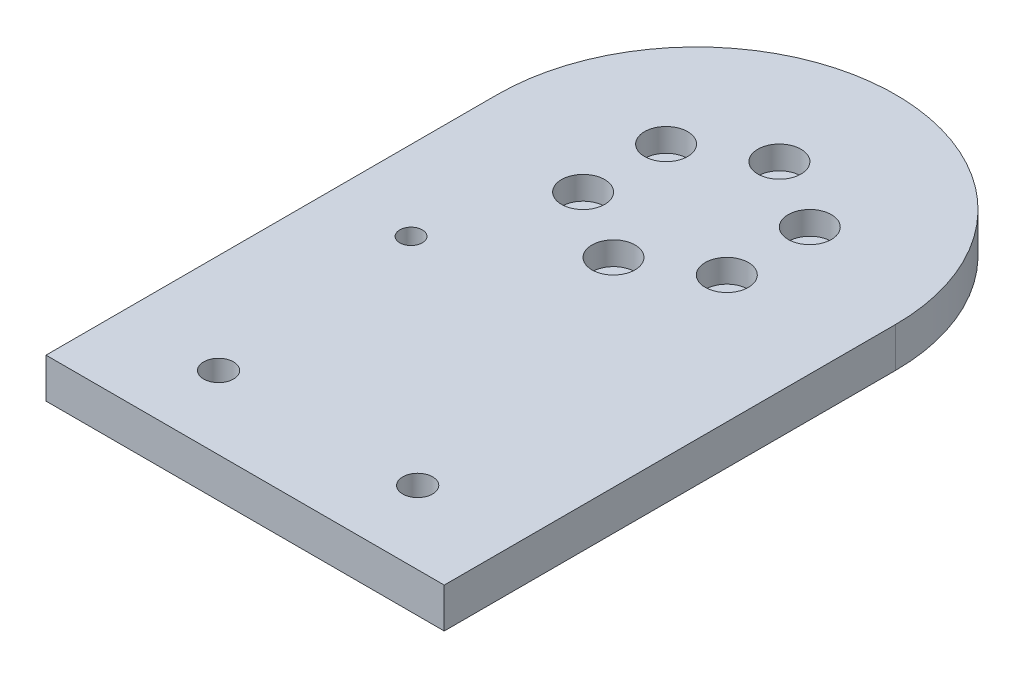
from build123d import *

# Parameters (mm, degrees)
PLACA_START               = 59.75
SK_PLACA_W                = 60
SK_PLACA_H                = 49
PLACA_DEPTH               = 6
EXTREMO_START             = 59.75
SK_EXTREMO_R              = 30
EXTREMO_DEPTH             = 6
PASANTES_M3_CUBO_J3_START = 59.75
SK_PASANTES_M3_CUBO_J3_R  = 1.7
PASANTES_M3_CUBO_J3_DEPTH = 6
CAJAS_M3_J3_START         = 62.25
SK_CAJAS_M3_J3_R          = 3.25
CAJAS_M3_J3_DEPTH         = 3.5
EXTENSION_PESTANAS_START  = 59.75
SK_EXTENSION_PESTANAS_W   = 60
SK_EXTENSION_PESTANAS_H   = 19
EXTENSION_PESTANAS_DEPTH  = 6
PASANTES_M4_REPISA_START  = 59.75
SK_PASANTES_M4_REPISA_R   = 2.25
PASANTES_M4_REPISA_DEPTH  = 6
PASANTE_M3_CINCHO_START   = 59.75
SK_PASANTE_M3_CINCHO_R    = 1.7
PASANTE_M3_CINCHO_DEPTH   = 6


with BuildPart() as part:
    # Sk_Placa → Placa (new body)
    with BuildSketch(Plane(origin=(0, 0, 0), x_dir=(1, 0, 0), z_dir=(0, 1, 0)).offset(PLACA_START)):
        with Locations((0, -354.5)):
            Rectangle(SK_PLACA_W, SK_PLACA_H)
    extrude(amount=PLACA_DEPTH)

    # Sk_Extremo → Extremo (add)
    with BuildSketch(Plane(origin=(0, 0, 0), x_dir=(1, 0, 0), z_dir=(0, 1, 0)).offset(EXTREMO_START)):
        with Locations((0, -330)):
            Circle(SK_EXTREMO_R)
    extrude(amount=EXTREMO_DEPTH)

    # Sk_Pasantes_M3_cubo_J3 → Pasantes_M3_cubo_J3 (cut)
    with BuildSketch(Plane(origin=(0, 0, 0), x_dir=(1, 0, 0), z_dir=(0, 1, 0)).offset(PASANTES_M3_CUBO_J3_START)):
        with Locations(Location((10.825317547, -336.25, 0), (0, 0, 270))):
            Circle(SK_PASANTES_M3_CUBO_J3_R)
        with Locations(Location((0, -342.5, 0), (0, 0, 270))):
            Circle(SK_PASANTES_M3_CUBO_J3_R)
        with Locations(Location((-10.825317547, -336.25, 0), (0, 0, 270))):
            Circle(SK_PASANTES_M3_CUBO_J3_R)
        with Locations(Location((-10.825317547, -323.75, 0), (0, 0, 270))):
            Circle(SK_PASANTES_M3_CUBO_J3_R)
        with Locations(Location((0, -317.5, 0), (0, 0, 270))):
            Circle(SK_PASANTES_M3_CUBO_J3_R)
        with Locations(Location((10.825317547, -323.75, 0), (0, 0, 270))):
            Circle(SK_PASANTES_M3_CUBO_J3_R)
    extrude(amount=PASANTES_M3_CUBO_J3_DEPTH, mode=Mode.SUBTRACT)

    # Sk_Cajas_M3_J3 → Cajas_M3_J3 (cut)
    with BuildSketch(Plane(origin=(0, 0, 0), x_dir=(1, 0, 0), z_dir=(0, 1, 0)).offset(CAJAS_M3_J3_START)):
        with Locations(Location((10.825317547, -336.25, 0), (0, 0, 270))):
            Circle(SK_CAJAS_M3_J3_R)
        with Locations(Location((0, -342.5, 0), (0, 0, 270))):
            Circle(SK_CAJAS_M3_J3_R)
        with Locations(Location((-10.825317547, -336.25, 0), (0, 0, 270))):
            Circle(SK_CAJAS_M3_J3_R)
        with Locations(Location((-10.825317547, -323.75, 0), (0, 0, 270))):
            Circle(SK_CAJAS_M3_J3_R)
        with Locations(Location((0, -317.5, 0), (0, 0, 270))):
            Circle(SK_CAJAS_M3_J3_R)
        with Locations(Location((10.825317547, -323.75, 0), (0, 0, 270))):
            Circle(SK_CAJAS_M3_J3_R)
    extrude(amount=CAJAS_M3_J3_DEPTH, mode=Mode.SUBTRACT)

    # Sk_Extension_pestanas → Extension_pestanas (add)
    with BuildSketch(Plane(origin=(0, 0, 0), x_dir=(1, 0, 0), z_dir=(0, 1, 0)).offset(EXTENSION_PESTANAS_START)):
        with Locations((0, -388.5)):
            Rectangle(SK_EXTENSION_PESTANAS_W, SK_EXTENSION_PESTANAS_H)
    extrude(amount=EXTENSION_PESTANAS_DEPTH)

    # Sk_Pasantes_M4_repisa → Pasantes_M4_repisa (cut)
    with BuildSketch(Plane(origin=(0, 0, 0), x_dir=(1, 0, 0), z_dir=(0, 1, 0)).offset(PASANTES_M4_REPISA_START)):
        with Locations(Location((-15, -387, 0), (0, 0, 270))):
            Circle(SK_PASANTES_M4_REPISA_R)
        with Locations(Location((15, -387, 0), (0, 0, 270))):
            Circle(SK_PASANTES_M4_REPISA_R)
    extrude(amount=PASANTES_M4_REPISA_DEPTH, mode=Mode.SUBTRACT)

    # Sk_Pasante_M3_cincho → Pasante_M3_cincho (cut)
    with BuildSketch(Plane(origin=(0, 0, 0), x_dir=(1, 0, 0), z_dir=(0, 1, 0)).offset(PASANTE_M3_CINCHO_START)):
        with Locations(Location((-18, -355, 0), (0, 0, 270))):
            Circle(SK_PASANTE_M3_CINCHO_R)
    extrude(amount=PASANTE_M3_CINCHO_DEPTH, mode=Mode.SUBTRACT)


solid = part.part
